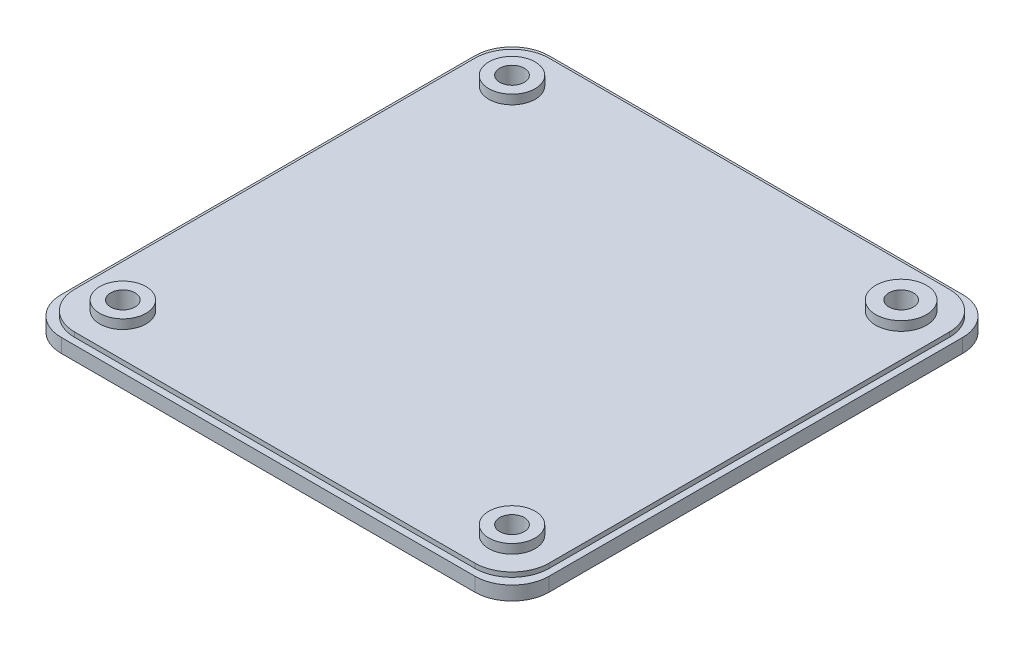
from build123d import *

# Parameters (mm, degrees)
BASEPLATE_W         = 105.3
BASEPLATE_H         = 105.3
BOSS_EXTRUDE1_DEPTH = 4
STANDS_R            = 5
STANDS_R_2          = 5.479963535
BOSS_EXTRUDE3_DEPTH = 2
CUT_EXTRUDE1_REACH  = 151.038
MOUNTING_HOLES_R    = 2.65
EDGE_CUTOUT_W       = 105.3
EDGE_CUTOUT_H       = 105.3
EDGE_CUTOUT_W_2     = 102.4
EDGE_CUTOUT_H_2     = 102.4
CUT_EXTRUDE2_DEPTH  = 1
FILLET_EDGES_R      = 8


with BuildPart() as part:
    # Baseplate → Boss-Extrude1 (new body)
    with BuildSketch(Plane(origin=(0, 0, 0), x_dir=(1, 0, 0), z_dir=(0, 1, 0))):
        with Locations((52.65, -52.65)):
            Rectangle(BASEPLATE_W, BASEPLATE_H)
    extrude(amount=BOSS_EXTRUDE1_DEPTH)

    # Stands → Boss-Extrude3 (add)
    with BuildSketch(Plane(origin=(0, 4, 0), x_dir=(1, 0, 0), z_dir=(0, 1, 0))):
        with Locations(Location((10.65, -10.65, 0), (0, 0, 270))):
            Circle(STANDS_R)
        with Locations(Location((94.65, -10.65, 0), (0, 0, 270))):
            Circle(STANDS_R_2)
        with Locations(Location((10.65, -94.65, 0), (0, 0, 270))):
            Circle(STANDS_R)
        with Locations(Location((94.65, -94.65, 0), (0, 0, 270))):
            Circle(STANDS_R)
    extrude(amount=BOSS_EXTRUDE3_DEPTH)

    # Mounting_Holes → Cut-Extrude1 (cut, up to next)
    with BuildSketch(Plane(origin=(0, 6, 0), x_dir=(1, 0, 0), z_dir=(0, 1, 0)), mode=Mode.PRIVATE) as cut_extrude1_sk1:
        with Locations(Location((10.65, -10.65, 0), (0, 0, 270))):
            Circle(MOUNTING_HOLES_R)
    cut_extrude1_tool1 = extrude(cut_extrude1_sk1.sketch, amount=-CUT_EXTRUDE1_REACH, mode=Mode.PRIVATE) & part.part
    # Mounting_Holes → Cut-Extrude1 (cut, up to next)
    with BuildSketch(Plane(origin=(0, 6, 0), x_dir=(1, 0, 0), z_dir=(0, 1, 0)), mode=Mode.PRIVATE) as cut_extrude1_sk2:
        with Locations(Location((94.65, -10.65, 0), (0, 0, 270))):
            Circle(MOUNTING_HOLES_R)
    cut_extrude1_tool2 = extrude(cut_extrude1_sk2.sketch, amount=-CUT_EXTRUDE1_REACH, mode=Mode.PRIVATE) & part.part
    # Mounting_Holes → Cut-Extrude1 (cut, up to next)
    with BuildSketch(Plane(origin=(0, 6, 0), x_dir=(1, 0, 0), z_dir=(0, 1, 0)), mode=Mode.PRIVATE) as cut_extrude1_sk3:
        with Locations(Location((94.65, -94.65, 0), (0, 0, 270))):
            Circle(MOUNTING_HOLES_R)
    cut_extrude1_tool3 = extrude(cut_extrude1_sk3.sketch, amount=-CUT_EXTRUDE1_REACH, mode=Mode.PRIVATE) & part.part
    # Mounting_Holes → Cut-Extrude1 (cut, up to next)
    with BuildSketch(Plane(origin=(0, 6, 0), x_dir=(1, 0, 0), z_dir=(0, 1, 0)), mode=Mode.PRIVATE) as cut_extrude1_sk4:
        with Locations(Location((10.65, -94.65, 0), (0, 0, 270))):
            Circle(MOUNTING_HOLES_R)
    cut_extrude1_tool4 = extrude(cut_extrude1_sk4.sketch, amount=-CUT_EXTRUDE1_REACH, mode=Mode.PRIVATE) & part.part
    add(cut_extrude1_tool1.solids().sort_by_distance((10.65, 6, 10.65))[0], mode=Mode.SUBTRACT)
    add(cut_extrude1_tool2.solids().sort_by_distance((94.65, 6, 10.65))[0], mode=Mode.SUBTRACT)
    add(cut_extrude1_tool3.solids().sort_by_distance((94.65, 6, 94.65))[0], mode=Mode.SUBTRACT)
    add(cut_extrude1_tool4.solids().sort_by_distance((10.65, 6, 94.65))[0], mode=Mode.SUBTRACT)

    # Edge_Cutout → Cut-Extrude2 (cut)
    with BuildSketch(Plane(origin=(0, 4, 0), x_dir=(1, 0, 0), z_dir=(0, 1, 0))):
        with Locations((52.65, -52.65)):
            Rectangle(EDGE_CUTOUT_W, EDGE_CUTOUT_H)
        with Locations((52.65, -52.65)):
            Rectangle(EDGE_CUTOUT_W_2, EDGE_CUTOUT_H_2, mode=Mode.SUBTRACT)
    extrude(amount=-CUT_EXTRUDE2_DEPTH, mode=Mode.SUBTRACT)

    # Fillet_Edges
    fillet_edges_edges = [part.edges().sort_by_distance(p)[0] for p in [
        (0, 1.5, 0),
        (105.3, 1.5, 0),
        (105.3, 1.5, 105.3),
        (0, 1.5, 105.3),
        (1.45, 3.5, 1.45),
        (103.85, 3.5, 1.45),
        (103.85, 3.5, 103.85),
        (1.45, 3.5, 103.85),
    ]]
    fillet(fillet_edges_edges, radius=FILLET_EDGES_R)


solid = part.part
